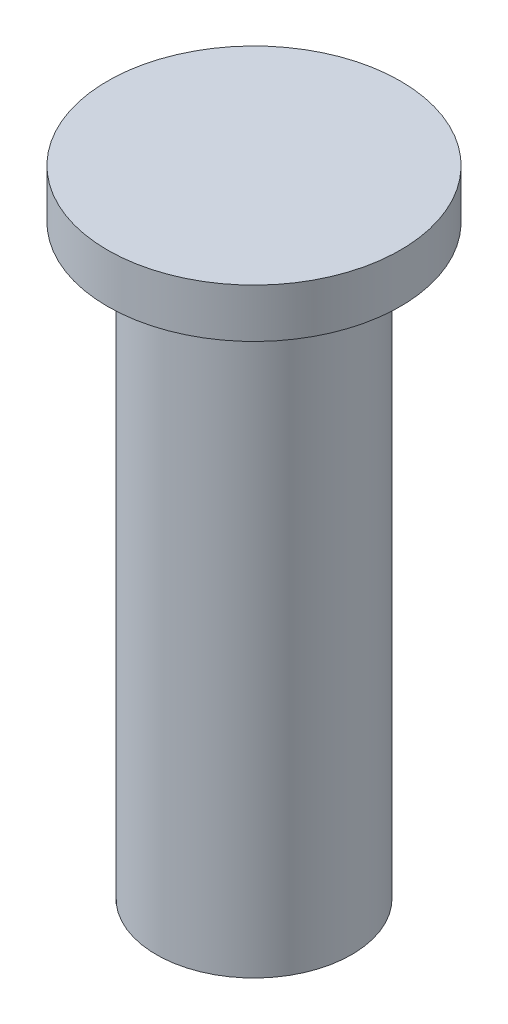
from build123d import *

# Parameters (mm, degrees)
SKETCH1_R           = 12.7
BOSS_EXTRUDE1_DEPTH = 76.2
SKETCH2_R           = 19.05
BOSS_EXTRUDE2_DEPTH = 6.35


with BuildPart() as part:
    # Sketch1 → Boss-Extrude1 (new body)
    with BuildSketch(Plane(origin=(0, 0, 0), x_dir=(1, 0, 0), z_dir=(0, 1, 0))):
        with Locations(Location((0, 0, 0), (0, 0, 90))):
            Circle(SKETCH1_R)
    extrude(amount=BOSS_EXTRUDE1_DEPTH)

    # Sketch2 → Boss-Extrude2 (add)
    with BuildSketch(Plane(origin=(0, 76.2, 0), x_dir=(1, 0, 0), z_dir=(0, 1, 0))):
        with Locations(Location((0, 0, 0), (0, 0, 270))):
            Circle(SKETCH2_R)
    extrude(amount=BOSS_EXTRUDE2_DEPTH)


solid = part.part
